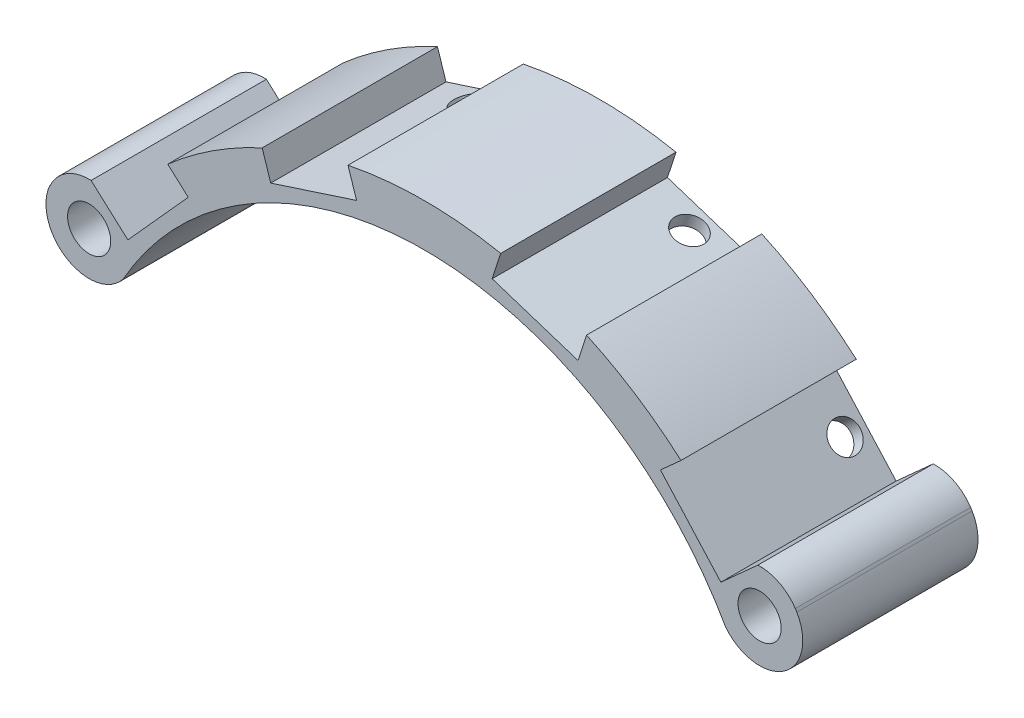
from build123d import *

# Parameters (mm, degrees)
ESBO_O2_R                = 2.5
RESSALTO_EXTRUS_O1_DEPTH = 20.3
ESBO_O3_R                = 1.75
CORTE_EXTRUS_O1_DEPTH    = 20.3
ESBO_O4_W                = 10.45
ESBO_O4_H                = 20.3
CORTE_EXTRUS_O3_DEPTH    = 8.5
ESBO_O5_W                = 20.3
ESBO_O5_H                = 10.45
CORTE_EXTRUS_O4_DEPTH    = 8.5
ESBO_O6_W                = 10.45
ESBO_O6_H                = 20.3
CORTE_EXTRUS_O5_DEPTH    = 8.5
ESBO_O7_W                = 20.3
ESBO_O7_H                = 10.45
CORTE_EXTRUS_O6_DEPTH    = 8.5
ESBO_O8_R                = 1.75
CORTE_EXTRUS_O7_DEPTH    = 8
ESBO_O10_R               = 1.75
CORTE_EXTRUS_O8_DEPTH    = 8
ESBO_O9_R                = 1.75
CORTE_EXTRUS_O9_DEPTH    = 8
CORTE_EXTRUS_O10_DEPTH   = 70.517266152
CORTE_EXTRUS_O13_DEPTH   = 70.517266152


with BuildPart() as part:
    # Esboço2 → Ressalto-extrusão1 (new body)
    with BuildSketch(Plane.XY):
        with BuildLine():
            ThreePointArc((43.137997257, 25.280688137), (0, 50), (-43.137997257, 25.280688137))
            ThreePointArc((-43.137997257, 25.280688137), (-41.634338387, 18.617028874), (-34.88523184, 19.672919779))
            ThreePointArc((-34.88523184, 19.672919779), (0, 40.050008404), (34.88523184, 19.672919779))
            ThreePointArc((34.88523184, 19.672919779), (41.634338387, 18.617028874), (43.137997257, 25.280688137))
        make_face()
        with Locations((-38.824197531, 22.752619324)):
            Circle(ESBO_O2_R, mode=Mode.SUBTRACT)
        with Locations((38.824197531, 22.752619324)):
            Circle(ESBO_O2_R, mode=Mode.SUBTRACT)
    extrude(amount=RESSALTO_EXTRUS_O1_DEPTH)

    # Esboço3 → Corte-extrusão1 (cut)
    with BuildSketch(Plane(origin=(15.450849719, 47.552825815, 0), x_dir=(0.9510565162951546, -0.30901699437494434, 0), z_dir=(0.3090169943749443, 0.9510565162951545, 0))):
        with Locations(Location((0, -2.42, 0), (0, 0, 180))):
            Circle(ESBO_O3_R)
    extrude(amount=-CORTE_EXTRUS_O1_DEPTH, mode=Mode.SUBTRACT)

    # Esboço4 → Corte-extrusão3 (cut)
    with BuildSketch(Plane(origin=(15.450849719, 47.552825815, 0), x_dir=(0.9510565162951546, -0.30901699437494434, 0), z_dir=(0.3090169943749443, 0.9510565162951545, 0))):
        with Locations((0, -10.15)):
            Rectangle(ESBO_O4_W, ESBO_O4_H)
    extrude(amount=-CORTE_EXTRUS_O3_DEPTH, mode=Mode.SUBTRACT)

    # Esboço5 → Corte-extrusão4 (cut)
    with BuildSketch(Plane(origin=(37.157241274, 33.456530318, 0), x_dir=(0, 0, -1), z_dir=(0.743144825477393, 0.6691306063588597, 0))):
        with Locations((-10.15, 0)):
            Rectangle(ESBO_O5_W, ESBO_O5_H)
    extrude(amount=-CORTE_EXTRUS_O4_DEPTH, mode=Mode.SUBTRACT)

    # Esboço6 → Corte-extrusão5 (cut)
    with BuildSketch(Plane(origin=(-15.450849719, 47.552825815, 0), x_dir=(0.9510565162951555, 0.3090169943749416, 0), z_dir=(-0.3090169943749416, 0.9510565162951555, 0))):
        with Locations((0, -10.15)):
            Rectangle(ESBO_O6_W, ESBO_O6_H)
    extrude(amount=-CORTE_EXTRUS_O5_DEPTH, mode=Mode.SUBTRACT)

    # Esboço7 → Corte-extrusão6 (cut)
    with BuildSketch(Plane(origin=(-37.157241274, 33.456530318, 0), x_dir=(0, 0, 1), z_dir=(-0.7431448254773863, 0.6691306063588672, 0))):
        with Locations((10.15, 0)):
            Rectangle(ESBO_O7_W, ESBO_O7_H)
    extrude(amount=-CORTE_EXTRUS_O6_DEPTH, mode=Mode.SUBTRACT)

    # Esboço8 → Corte-extrusão7 (cut)
    with BuildSketch(Plane(origin=(30.840510257, 27.768920164, 0), x_dir=(0, 0, -1), z_dir=(0.7431448254773932, 0.6691306063588595, 0))):
        with Locations(Location((-2.42, 0, 0), (0, 0, 90))):
            Circle(ESBO_O8_R)
    extrude(amount=-CORTE_EXTRUS_O7_DEPTH, mode=Mode.SUBTRACT)

    # Esboço10 → Corte-extrusão8 (cut)
    with BuildSketch(Plane(origin=(-30.840510257, 27.768920164, 0), x_dir=(0, 0, 1), z_dir=(-0.7431448254773859, 0.6691306063588675, 0))):
        with Locations(Location((2.42, 0, 0), (0, 0, 270))):
            Circle(ESBO_O10_R)
    extrude(amount=-CORTE_EXTRUS_O8_DEPTH, mode=Mode.SUBTRACT)

    # Esboço9 → Corte-extrusão9 (cut)
    with BuildSketch(Plane(origin=(-12.824205267, 39.468845426, 0), x_dir=(0.9510565162951553, 0.309016994374942, 0), z_dir=(-0.309016994374942, 0.9510565162951553, 0))):
        with Locations(Location((0, -2.42, 0), (0, 0, 180))):
            Circle(ESBO_O9_R)
    extrude(amount=-CORTE_EXTRUS_O9_DEPTH, mode=Mode.SUBTRACT)

    # Esboço11 → Corte-extrusão10 (cut, through all)
    with BuildSketch(Plane.XY.offset(20.3)):
        with BuildLine():
            Line((-40.450008581, 29.390420306), (-38.593336029, 27.718664832))
            ThreePointArc((-38.593336029, 27.718664832), (-41.446519528, 26.976164323), (-43.377460924, 24.74828901))
            Line((-43.377460924, 24.74828901), (-42.327289397, 29.390420306))
            Line((-42.327289397, 29.390420306), (-40.450008581, 29.390420306))
        make_face()
        with BuildLine():
            Line((38.629484885, 27.751213408), (40.450008581, 29.390420306))
            Line((40.450008581, 29.390420306), (42.795606827, 28.974236974))
            Line((42.795606827, 28.974236974), (42.969901633, 25.552082367))
            ThreePointArc((42.969901633, 25.552082367), (41.08508844, 27.214931295), (38.629484885, 27.751213408))
        make_face()
    extrude(amount=-CORTE_EXTRUS_O10_DEPTH, mode=Mode.SUBTRACT)

    # Esboço13 → Corte-extrusão13 (cut, through all)
    with BuildSketch(Plane.XY.offset(20.3)):
        with BuildLine():
            Line((-43.591003867, 44.387154562), (-0.084802266, 65.050582409))
            Line((-0.084802266, 65.050582409), (44.470714032, 40.916344415))
            Line((44.470714032, 40.916344415), (33.115675704, 30.468869731))
            ThreePointArc((33.115675704, 30.468869731), (-0.45988999, 44.997649952), (-33.731495865, 29.785670828))
            Line((-33.731495865, 29.785670828), (-43.591003867, 44.387154562))
        make_face()
    extrude(amount=-CORTE_EXTRUS_O13_DEPTH, mode=Mode.SUBTRACT)


solid = part.part
